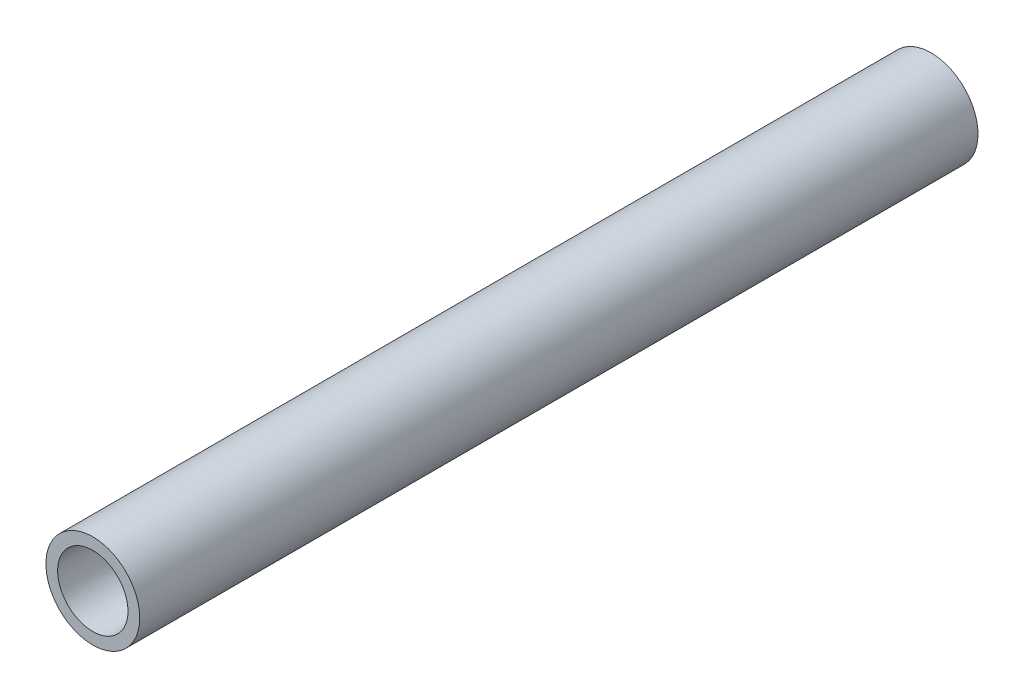
from build123d import *

# Parameters (mm, degrees)
SKETCH1_R           = 4
SKETCH1_R_2         = 3
EXTRUDE_THIN1_DEPTH = 71.5


with BuildPart() as part:
    # Sketch1 → Extrude-Thin1 (new body)
    with BuildSketch(Plane.XY):
        Circle(SKETCH1_R)
        Circle(SKETCH1_R_2, mode=Mode.SUBTRACT)
    extrude(amount=EXTRUDE_THIN1_DEPTH)


solid = part.part
